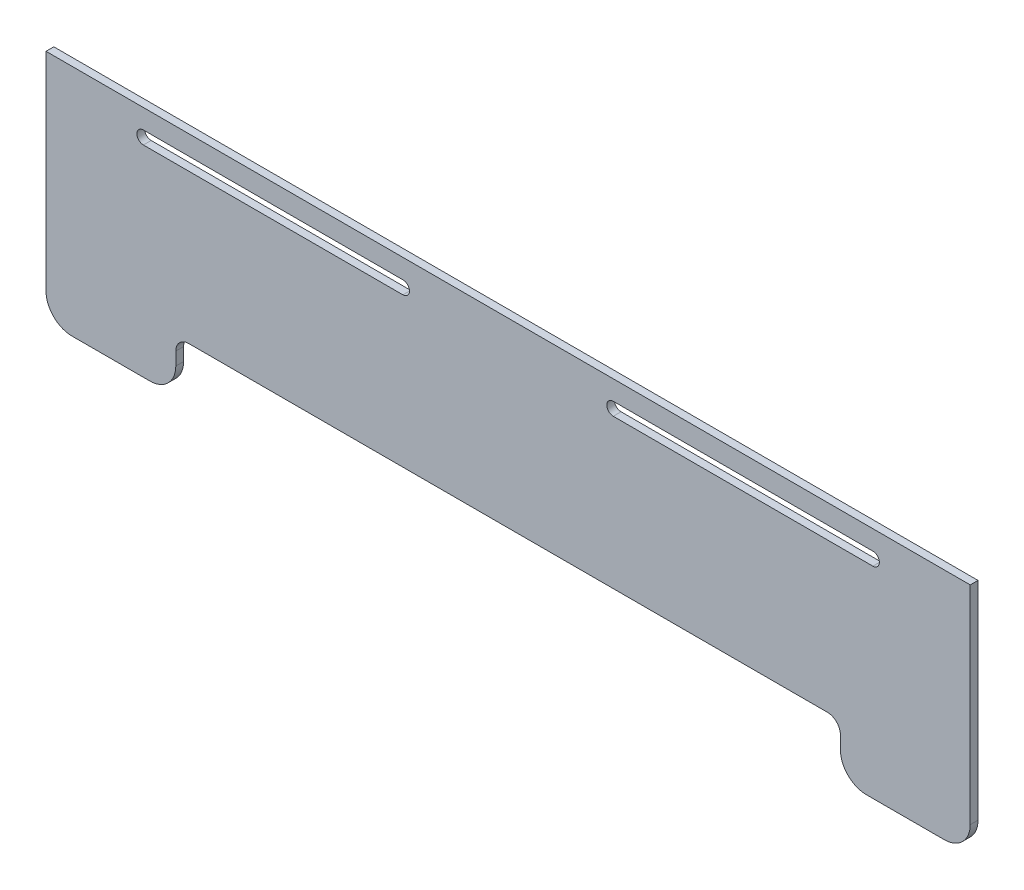
from build123d import *

# Parameters (mm, degrees)
BOSS_EXTRUDE1_DEPTH = 3


with BuildPart() as part:
    # Sketch1 → Boss-Extrude1 (new body)
    with BuildSketch(Plane.XY):
        with BuildLine():
            Line((-178, 0), (178, 0))
            Line((178, 0), (178, -80))
            ThreePointArc((178, -80), (175.071067812, -87.071067812), (168, -90))
            Line((168, -90), (138, -90))
            ThreePointArc((138, -90), (130.928932188, -87.071067812), (128, -80))
            Line((128, -80), (128, -75))
            ThreePointArc((128, -75), (126.535533906, -71.464466094), (123, -70))
            Line((123, -70), (-123, -70))
            ThreePointArc((-123, -70), (-126.535533906, -71.464466094), (-128, -75))
            Line((-128, -75), (-128, -80))
            ThreePointArc((-128, -80), (-130.928932188, -87.071067812), (-138, -90))
            Line((-138, -90), (-168, -90))
            ThreePointArc((-168, -90), (-175.071067812, -87.071067812), (-178, -80))
            Line((-178, -80), (-178, 0))
        make_face()
        with BuildLine():
            Line((40.5, -7.5), (140.5, -7.5))
            ThreePointArc((140.5, -7.5), (143, -10), (140.5, -12.5))
            Line((140.5, -12.5), (40.5, -12.5))
            ThreePointArc((40.5, -12.5), (38, -10), (40.5, -7.5))
        make_face(mode=Mode.SUBTRACT)
        with BuildLine():
            Line((-40.5, -7.5), (-140.5, -7.5))
            ThreePointArc((-140.5, -7.5), (-143, -10), (-140.5, -12.5))
            Line((-140.5, -12.5), (-40.5, -12.5))
            ThreePointArc((-40.5, -12.5), (-38, -10), (-40.5, -7.5))
        make_face(mode=Mode.SUBTRACT)
    extrude(amount=BOSS_EXTRUDE1_DEPTH)


solid = part.part
